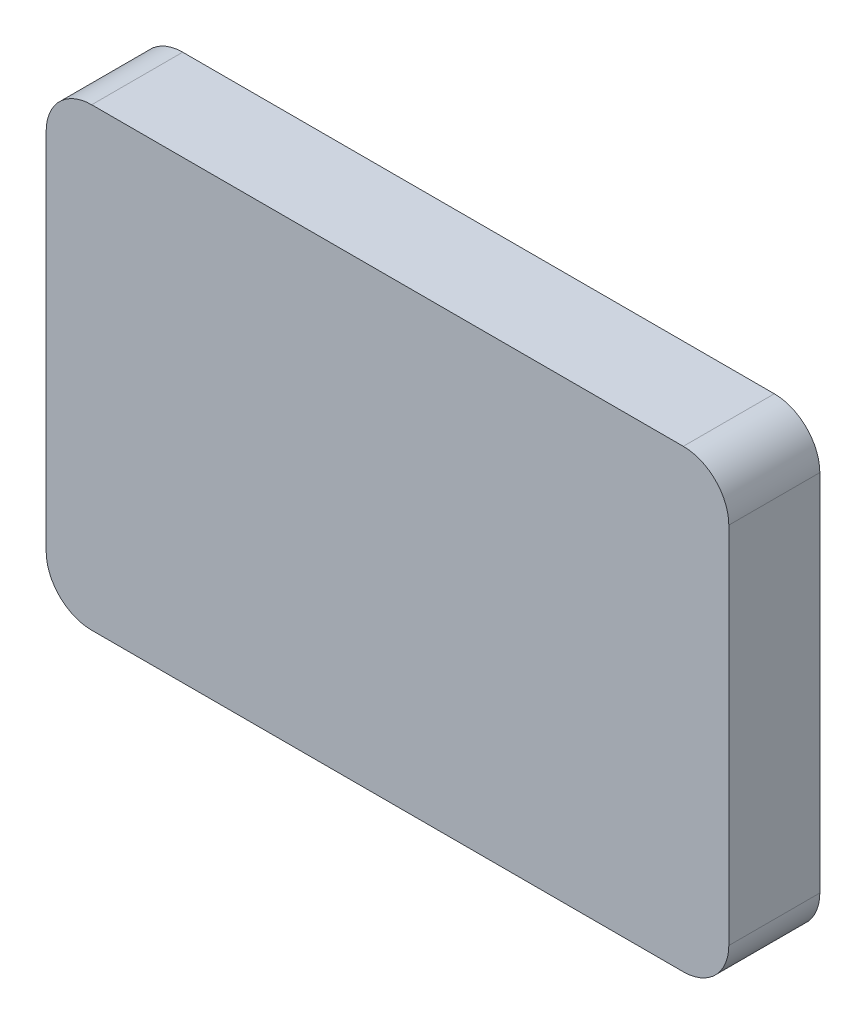
from build123d import *

# Parameters (mm, degrees)
BOSS_EXTRUDE2_DEPTH = 2
FILLET1_R           = 1


with BuildPart() as part:
    # Sketch1 → Boss-Extrude2 (new body)
    with BuildSketch(Plane.XY):
        Polygon((0, 10), (0, 0), (15, 0), (15, 3.9872583), (15, 6.25), (15, 10), align=None)
    extrude(amount=BOSS_EXTRUDE2_DEPTH)

    # Fillet1
    fillet1_edges = [part.edges().sort_by_distance(p)[0] for p in [
        (0, 0, 1),
        (0, 10, 1),
        (15, 10, 1),
        (15, 0, 1),
    ]]
    fillet(fillet1_edges, radius=FILLET1_R)


solid = part.part
